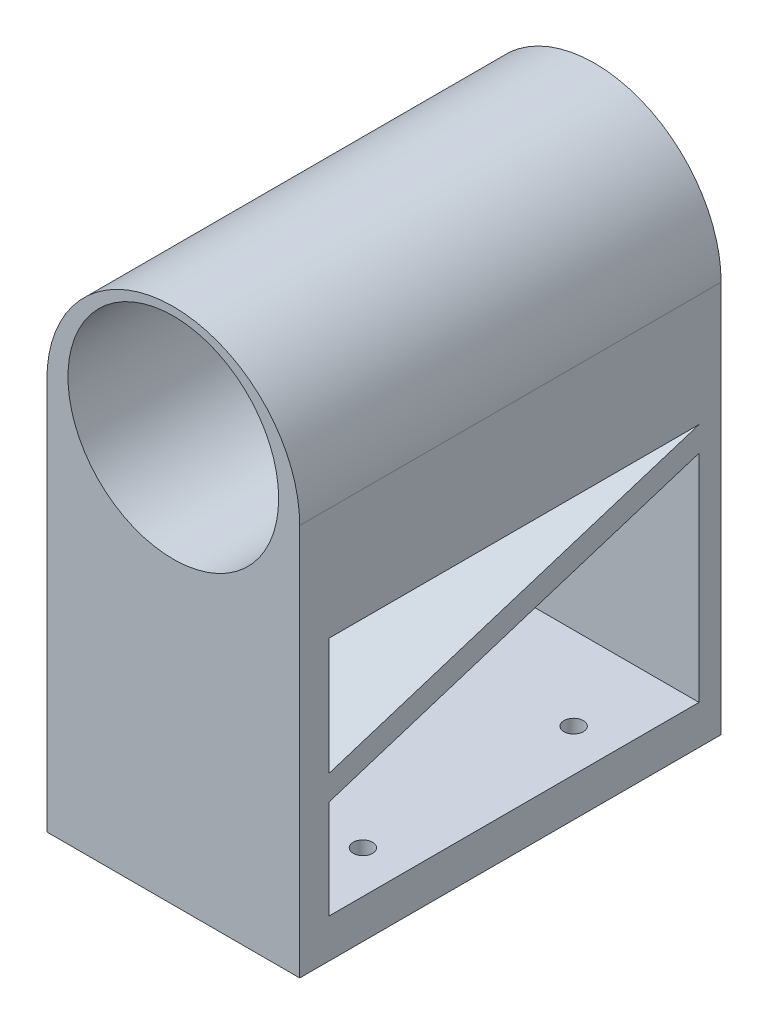
from build123d import *

# Parameters (mm, degrees)
BOSS_EXTRUDE1_DEPTH = 50.8
SKETCH2_R           = 12.7
CUT_EXTRUDE1_DEPTH  = 50.8
CUT_EXTRUDE2_DEPTH  = 50.8
SKETCH5_R           = 1.166747446
CUT_EXTRUDE3_DEPTH  = 7.62


with BuildPart() as part:
    # Sketch1 → Boss-Extrude1 (new body)
    with BuildSketch(Plane.XY):
        with BuildLine():
            Line((17.78, 16.984869565), (17.78, -30.259130435))
            Line((17.78, -30.259130435), (-12.7, -30.259130435))
            Line((-12.7, -30.259130435), (-12.7, 16.984869565))
            ThreePointArc((-12.7, 16.984869565), (2.54, 32.224869565), (17.78, 16.984869565))
        make_face()
    extrude(amount=BOSS_EXTRUDE1_DEPTH)

    # Sketch2 → Cut-Extrude1 (cut)
    with BuildSketch(Plane.XY.offset(50.8)):
        with Locations((2.54, 18.54261415)):
            Circle(SKETCH2_R)
    extrude(amount=-CUT_EXTRUDE1_DEPTH, mode=Mode.SUBTRACT)

    # Sketch4 → Cut-Extrude2 (cut)
    with BuildSketch(Plane(origin=(17.78, 0, 0), x_dir=(0, 0, -1), z_dir=(1, 0, 0))):
        Polygon((-47.247044422, 3.453714402), (-2.664546428, 3.453714402), (-47.247044422, -10.657322195), align=None)
        Polygon((-47.247044422, -13.645405957), (-2.664546428, 0.46563064), (-2.664546428, -25.553882978), (-47.247044422, -25.553882978), align=None)
    extrude(amount=-CUT_EXTRUDE2_DEPTH, mode=Mode.SUBTRACT)

    # Sketch5 → Cut-Extrude3 (cut)
    with BuildSketch(Plane(origin=(0, -30.259130435, 0), x_dir=(-1, 0, 0), z_dir=(0, -1, 0))):
        with Locations(Location((7.62, -12.7, 0), (0, 0, 90))):
            Circle(SKETCH5_R)
        with Locations(Location((7.62, -38.1, 0), (0, 0, 90))):
            Circle(SKETCH5_R)
        with Locations(Location((-12.7, -38.1, 0), (0, 0, 90))):
            Circle(SKETCH5_R)
        with Locations(Location((-12.7, -12.7, 0), (0, 0, 90))):
            Circle(SKETCH5_R)
    extrude(amount=-CUT_EXTRUDE3_DEPTH, mode=Mode.SUBTRACT)


solid = part.part
